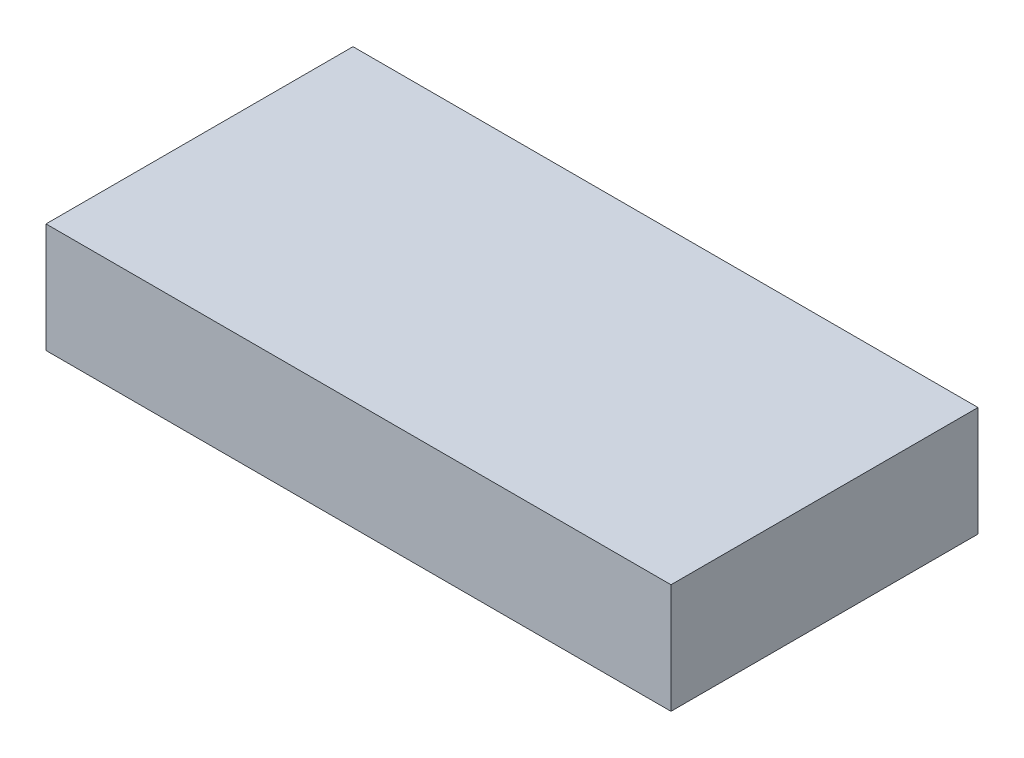
from build123d import *

# Parameters (mm, degrees)
SKETCH1_W           = 57
SKETCH1_H           = 28
BOSS_EXTRUDE1_DEPTH = 10


with BuildPart() as part:
    # Sketch1 → Boss-Extrude1 (new body)
    with BuildSketch(Plane(origin=(0, 0, 0), x_dir=(1, 0, 0), z_dir=(0, 1, 0))):
        Rectangle(SKETCH1_W, SKETCH1_H)
    extrude(amount=BOSS_EXTRUDE1_DEPTH)


solid = part.part
